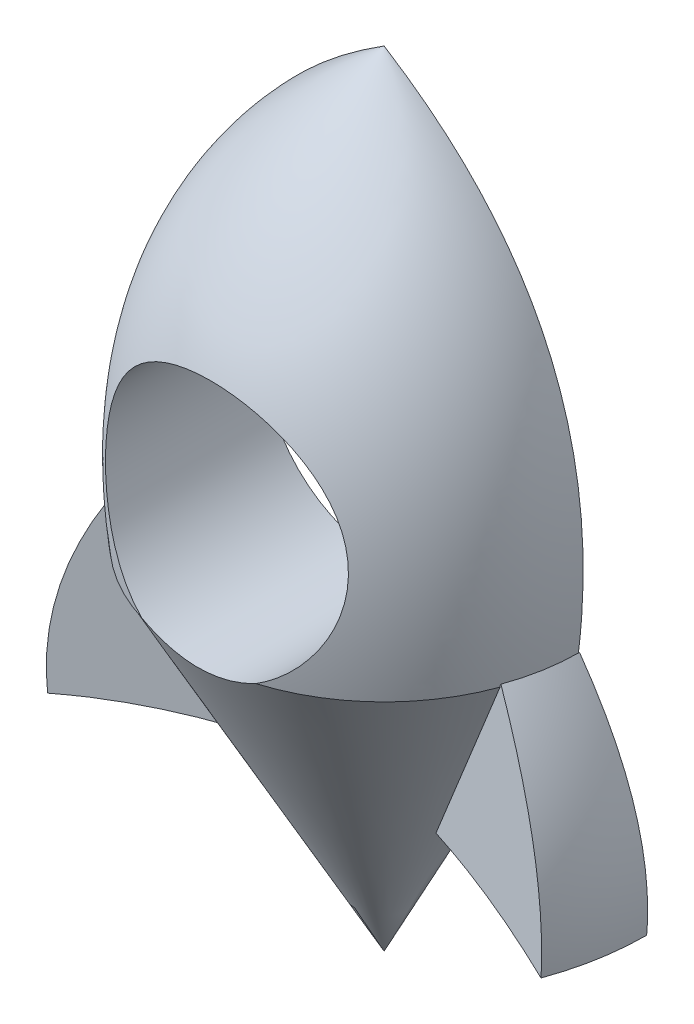
from build123d import *

# Parameters (mm, degrees)
REVOLVE1_ANGLE           = 180
SKETCH2_R                = 11.607478401
CUT_EXTRUDE1_DEPTH       = 30
REVOLVE3_ANGLE           = 20
REVOLVE3_OTHER_WAY_ANGLE = 20
SKETCH6_W                = 87.695776886
SKETCH6_H                = 110.7877302
CUT_EXTRUDE2_DEPTH       = 30


with BuildPart() as part:
    # Sketch1 → Revolve1 (revolve)
    with BuildSketch(Plane.XY):
        with BuildLine():
            Line((37.03427234, 1.564642505), (18.431130492, 35.41414573))
            add(Edge.make_bspline(
                [(18.431130492, 35.41414573), (14.894772629, 62.905623644), (37.03427234, 76.73235426)],
                knots=[0, 0, 0, 1, 1, 1], degree=2))
            Line((37.03427234, 76.73235426), (37.03427234, 57.257883484))
            ThreePointArc((37.03427234, 57.257883484), (25.426793939, 45.650405083), (37.03427234, 34.042926682))
            Line((37.03427234, 34.042926682), (37.03427234, 1.564642505))
        make_face()
    revolve(axis=Axis((37.03427234, 57.257883484, 0), (0, 1, 0)), revolution_arc=REVOLVE1_ANGLE)

    # Sketch2 → Cut-Extrude1 (cut)
    with BuildSketch(Plane(origin=(0, 0, 0), x_dir=(-1, 0, 0), z_dir=(0, 0, -1))):
        with Locations((-37.03427234, 45.650405083)):
            Circle(SKETCH2_R)
    extrude(amount=-CUT_EXTRUDE1_DEPTH, mode=Mode.SUBTRACT)

    # Sketch3 → Revolve3 (revolve)
    with BuildSketch(Plane(origin=(0, 0, 0), x_dir=(-1, 0, 0), z_dir=(0, 0, -1))):
        with BuildLine():
            Line((-55.774902941, 35.7486794), (-45.306584566, 16.700962649))
            add(Edge.make_bspline(
                [(-45.306584566, 16.700962649), (-54.069804725, 17.26279972), (-62.206909853, 15.470822713)],
                knots=[0, 0, 0, 0.385925107, 0.385925107, 0.385925107], degree=2))
            add(Edge.make_bspline(
                [(-55.774902941, 35.7486794), (-63.0996884, 25.437145822), (-62.206909853, 15.470822713)],
                knots=[0, 0, 0, 0.565089792, 0.565089792, 0.565089792], degree=2))
        make_face()
        with BuildLine():
            Line((-18.293641739, 35.7486794), (-28.761960114, 16.700962649))
            add(Edge.make_bspline(
                [(-28.761960114, 16.700962649), (-19.998739955, 17.26279972), (-11.861634828, 15.470822713)],
                knots=[0, 0, 0, 0.385925107, 0.385925107, 0.385925107], degree=2))
            add(Edge.make_bspline(
                [(-18.293641739, 35.7486794), (-10.96885628, 25.437145822), (-11.861634828, 15.470822713)],
                knots=[0, 0, 0, 0.565089792, 0.565089792, 0.565089792], degree=2))
        make_face()
    revolve(axis=Axis((37.03427234, 76.73235426, 0), (0, -1, 0)), revolution_arc=REVOLVE3_ANGLE)

    # Sketch3 → Revolve3 other way (revolve)
    with BuildSketch(Plane(origin=(0, 0, 0), x_dir=(-1, 0, 0), z_dir=(0, 0, -1))):
        with BuildLine():
            Line((-55.774902941, 35.7486794), (-45.306584566, 16.700962649))
            add(Edge.make_bspline(
                [(-45.306584566, 16.700962649), (-54.069804725, 17.26279972), (-62.206909853, 15.470822713)],
                knots=[0, 0, 0, 0.385925107, 0.385925107, 0.385925107], degree=2))
            add(Edge.make_bspline(
                [(-55.774902941, 35.7486794), (-63.0996884, 25.437145822), (-62.206909853, 15.470822713)],
                knots=[0, 0, 0, 0.565089792, 0.565089792, 0.565089792], degree=2))
        make_face()
        with BuildLine():
            Line((-18.293641739, 35.7486794), (-28.761960114, 16.700962649))
            add(Edge.make_bspline(
                [(-28.761960114, 16.700962649), (-19.998739955, 17.26279972), (-11.861634828, 15.470822713)],
                knots=[0, 0, 0, 0.385925107, 0.385925107, 0.385925107], degree=2))
            add(Edge.make_bspline(
                [(-18.293641739, 35.7486794), (-10.96885628, 25.437145822), (-11.861634828, 15.470822713)],
                knots=[0, 0, 0, 0.565089792, 0.565089792, 0.565089792], degree=2))
        make_face()
    revolve(axis=Axis((37.03427234, 76.73235426, 0), (0, 1, 0)), revolution_arc=REVOLVE3_OTHER_WAY_ANGLE)

    # Sketch6 → Cut-Extrude2 (cut)
    with BuildSketch(Plane(origin=(0, 0, 0), x_dir=(-1, 0, 0), z_dir=(0, 0, -1))):
        with Locations((-37.762446628, 42.00670517)):
            Rectangle(SKETCH6_W, SKETCH6_H)
    extrude(amount=CUT_EXTRUDE2_DEPTH, mode=Mode.SUBTRACT)


solid = part.part
